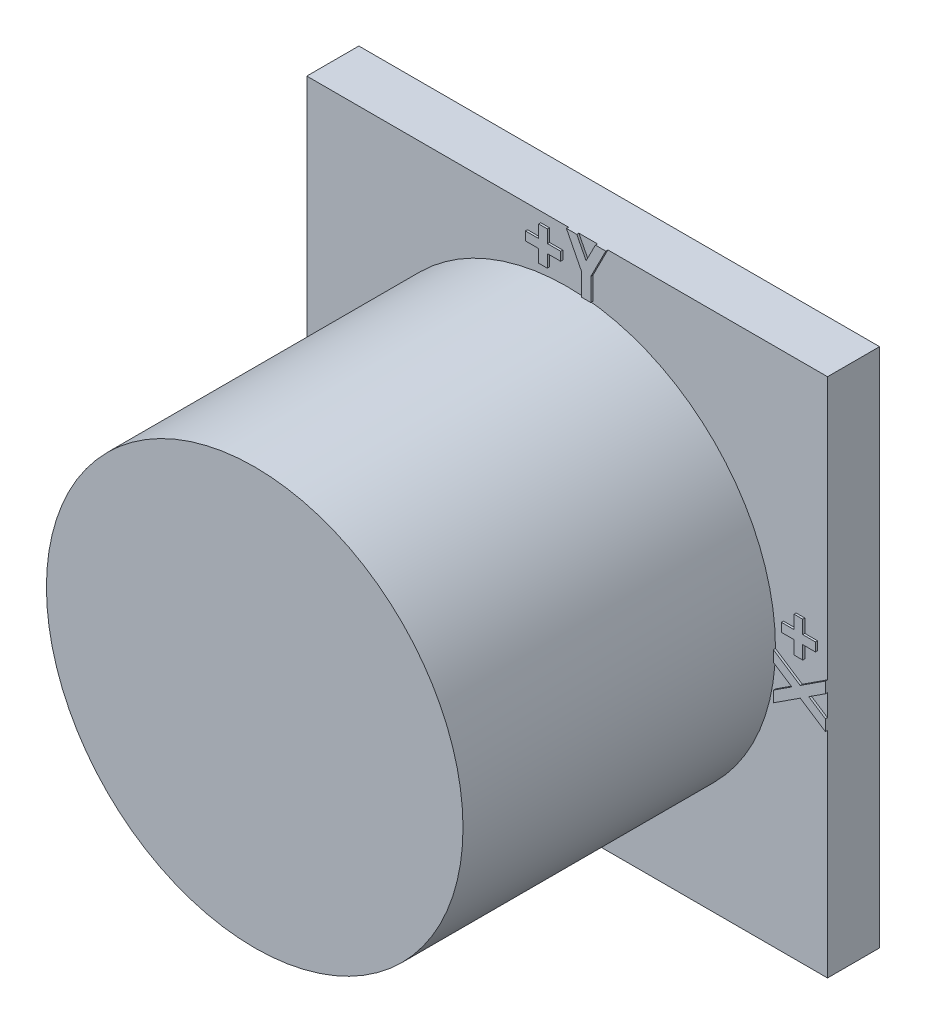
from build123d import *

# Parameters (mm, degrees)
SKETCH3_R           = 200
BOSS_EXTRUDE3_DEPTH = 300
BOSS_EXTRUDE4_START = -300
SKETCH3_3_W         = 500
SKETCH3_3_H         = 500
BOSS_EXTRUDE4_DEPTH = 50
SKETCH4_W           = 8.166666666
SKETCH4_H           = 16.961538461
SKETCH4_W_2         = 16.961538462
SKETCH4_H_2         = 8.166666666
BOSS_EXTRUDE5_DEPTH = 2


with BuildPart() as part:
    # Sketch3 → Boss-Extrude3 (new body)
    with BuildSketch(Plane.XY):
        Circle(SKETCH3_R)
    extrude(amount=-BOSS_EXTRUDE3_DEPTH)

    # Sketch3<3> → Boss-Extrude4 (add)
    with BuildSketch(Plane.XY.offset(BOSS_EXTRUDE4_START)):
        Rectangle(SKETCH3_3_W, SKETCH3_3_H)
    extrude(amount=-BOSS_EXTRUDE4_DEPTH)

    # Sketch4 → Boss-Extrude5 (add)
    with BuildSketch(Plane.XY.offset(-300)):
        Polygon((228.205128205, 25.641025641), (240.384615385, 25.641025641), (240.384615385, 17.307692308), (228.205128205, 17.307692308), (228.205128205, 4.487179487), (219.871794872, 4.487179487), (219.871794872, 17.307692308), (207.692307692, 17.307692308), (207.692307692, 25.641025641), (219.871794872, 25.641025641), (219.871794872, 38.461538462), (228.205128205, 38.461538462), align=None)
        Polygon((250, -2.073317308), (250, -12.650240385), (233.944310897, -23.096955128), (250, -33.563701923), (250, -44.150641026), (225.821314103, -28.385416667), (200, -45.192307692), (200, -34.615384615), (217.708333333, -23.096955128), (200, -11.548477564), (200, -0.961538462), (225.831330128, -17.80849359), align=None)
        Polygon((-25.320512821, 228.205128205), (-25.320512821, 240.384615385), (-16.987179487, 240.384615385), (-16.987179487, 228.205128205), (-4.166666667, 228.205128205), (-4.166666667, 219.871794872), (-16.987179487, 219.871794872), (-16.987179487, 207.692307692), (-25.320512821, 207.692307692), (-25.320512821, 219.871794872), (-38.141025641, 219.871794872), (-38.141025641, 228.205128205), align=None)
        Polygon((1.282051282, 250), (11.268028846, 250), (20.192307692, 232.461939103), (29.116586538, 250), (39.102564103, 250), (24.679487179, 221.654647436), (24.679487179, 200), (15.705128205, 200), (15.705128205, 221.654647436), align=None)
        Polygon((-201, 6.763020833), (-201, -3.602363782), (-216.734575321, -13.840144231), (-201, -24.09755609), (-201, -34.47275641), (-224.695112179, -19.022836538), (-250, -35.493589744), (-250, -25.128205128), (-232.645833333, -13.840144231), (-250, -2.522636218), (-250, 7.852564103), (-224.685296474, -8.657451923), align=None)
        with Locations((-232.096153846, 23.557692308)):
            Rectangle(SKETCH4_W, SKETCH4_H)
        with Locations((-17.58974359, -232.096153846)):
            Rectangle(SKETCH4_W_2, SKETCH4_H_2)
        Polygon((-1.884615385, -201), (7.901642628, -201), (16.647435897, -218.187299679), (25.393229167, -201), (35.179487179, -201), (21.044871795, -228.778445513), (21.044871795, -250), (12.25, -250), (12.25, -228.778445513), align=None)
    extrude(amount=BOSS_EXTRUDE5_DEPTH)


solid = part.part
